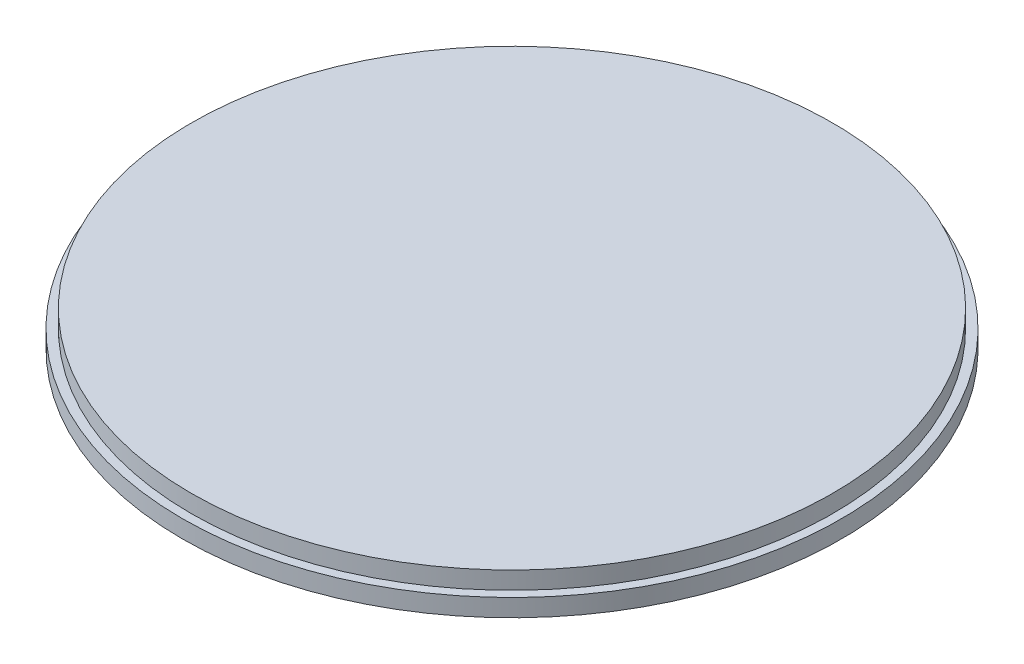
from build123d import *

# Parameters (mm, degrees)
SKETCH1_R           = 18.75
BOSS_EXTRUDE1_DEPTH = 2
SKETCH2_OUTSIDE_W   = 50.114
SKETCH2_OUTSIDE_H   = 50.114
SKETCH2_OUTSIDE_R   = 18.25
CUT_EXTRUDE1_DEPTH  = 1


with BuildPart() as part:
    # Sketch1 → Boss-Extrude1 (new body)
    with BuildSketch(Plane(origin=(0, 0, 0), x_dir=(1, 0, 0), z_dir=(0, 1, 0))):
        with Locations(Location((0, 0, 0), (0, 0, 270))):
            Circle(SKETCH1_R)
    extrude(amount=BOSS_EXTRUDE1_DEPTH)

    # Sketch2 outside → Cut-Extrude1 (cut)
    with BuildSketch(Plane(origin=(0, 2, 0), x_dir=(1, 0, 0), z_dir=(0, 1, 0))):
        Rectangle(SKETCH2_OUTSIDE_W, SKETCH2_OUTSIDE_H)
        with Locations(Location((0, 0, 0), (0, 0, 270))):
            Circle(SKETCH2_OUTSIDE_R, mode=Mode.SUBTRACT)
    extrude(amount=-CUT_EXTRUDE1_DEPTH, mode=Mode.SUBTRACT)


solid = part.part
